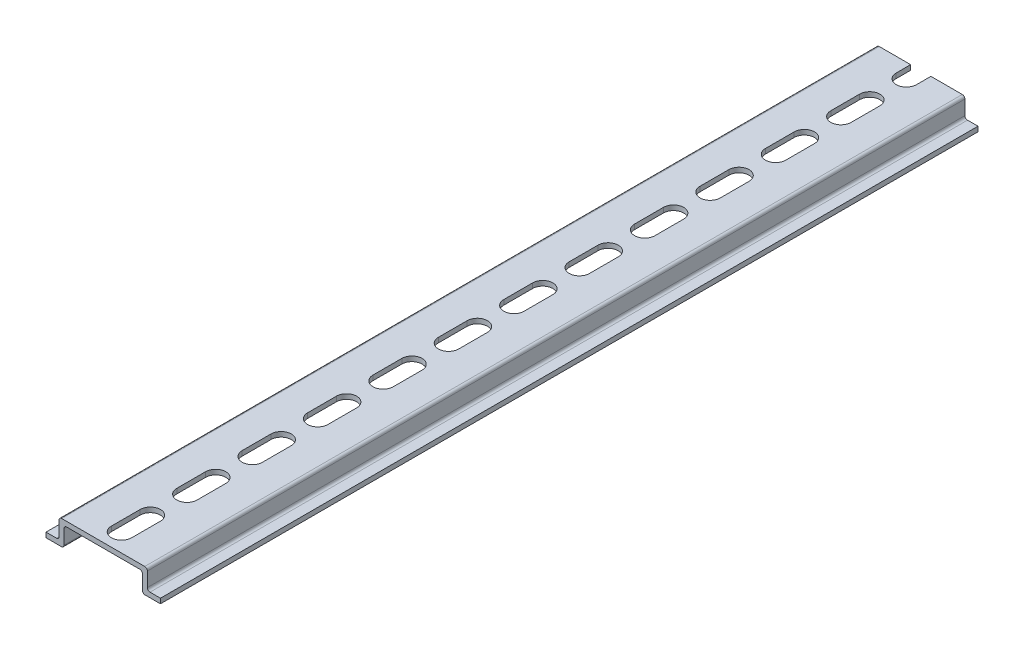
from build123d import *

# Parameters (mm, degrees)
EXTRUDE_1_DEPTH     = 250
CUT_EXTRUDE_2_DEPTH = 7.5


with BuildPart() as part:
    # 草图1 → 凸台-拉伸1 (new body)
    with BuildSketch(Plane.XY):
        with BuildLine():
            Line((-17.5, 0), (-12.8, 0))
            ThreePointArc((-12.8, 0), (-12.234314575, 0.234314575), (-12, 0.8))
            Line((-12, 0.8), (-12, 5.2))
            ThreePointArc((-12, 5.2), (-11.765685425, 5.765685425), (-11.2, 6))
            Line((-11.2, 6), (11.2, 6))
            ThreePointArc((11.2, 6), (11.765685425, 5.765685425), (12, 5.2))
            Line((12, 5.2), (12, 0.8))
            ThreePointArc((12, 0.8), (12.234314575, 0.234314575), (12.8, 0))
            Line((12.8, 0), (17.5, 0))
            Line((17.5, 0), (17.5, 1.5))
            Line((17.5, 1.5), (14.3, 1.5))
            ThreePointArc((14.3, 1.5), (13.734314575, 1.734314575), (13.5, 2.3))
            Line((13.5, 2.3), (13.5, 6.7))
            ThreePointArc((13.5, 6.7), (13.265685425, 7.265685425), (12.7, 7.5))
            Line((12.7, 7.5), (-12.7, 7.5))
            ThreePointArc((-12.7, 7.5), (-13.265685425, 7.265685425), (-13.5, 6.7))
            Line((-13.5, 6.7), (-13.5, 2.3))
            ThreePointArc((-13.5, 2.3), (-13.734314575, 1.734314575), (-14.3, 1.5))
            Line((-14.3, 1.5), (-17.5, 1.5))
            Line((-17.5, 1.5), (-17.5, 0))
        make_face()
    extrude(amount=EXTRUDE_1_DEPTH)

    # 草图2 → 切除-拉伸2 (cut)
    with BuildSketch(Plane(origin=(0, 0, 0), x_dir=(1, 0, 0), z_dir=(0, 1, 0))):
        with BuildLine():
            Line((3.1, 4.4), (3.1, -4.4))
            ThreePointArc((3.1, -4.4), (0, -7.5), (-3.1, -4.4))
            Line((-3.1, -4.4), (-3.1, 4.4))
            ThreePointArc((-3.1, 4.4), (0, 7.5), (3.1, 4.4))
        make_face()
        with BuildLine():
            Line((3.1, -15.6), (3.1, -24.4))
            ThreePointArc((3.1, -24.4), (0, -27.5), (-3.1, -24.4))
            Line((-3.1, -24.4), (-3.1, -15.6))
            ThreePointArc((-3.1, -15.6), (0, -12.5), (3.1, -15.6))
        make_face()
        with BuildLine():
            Line((3.1, -35.6), (3.1, -44.4))
            ThreePointArc((3.1, -44.4), (0, -47.5), (-3.1, -44.4))
            Line((-3.1, -44.4), (-3.1, -35.6))
            ThreePointArc((-3.1, -35.6), (0, -32.5), (3.1, -35.6))
        make_face()
        with BuildLine():
            Line((3.1, -55.6), (3.1, -64.4))
            ThreePointArc((3.1, -64.4), (0, -67.5), (-3.1, -64.4))
            Line((-3.1, -64.4), (-3.1, -55.6))
            ThreePointArc((-3.1, -55.6), (0, -52.5), (3.1, -55.6))
        make_face()
        with BuildLine():
            Line((3.1, -75.6), (3.1, -84.4))
            ThreePointArc((3.1, -84.4), (0, -87.5), (-3.1, -84.4))
            Line((-3.1, -84.4), (-3.1, -75.6))
            ThreePointArc((-3.1, -75.6), (0, -72.5), (3.1, -75.6))
        make_face()
        with BuildLine():
            Line((3.1, -95.6), (3.1, -104.4))
            ThreePointArc((3.1, -104.4), (0, -107.5), (-3.1, -104.4))
            Line((-3.1, -104.4), (-3.1, -95.6))
            ThreePointArc((-3.1, -95.6), (0, -92.5), (3.1, -95.6))
        make_face()
        with BuildLine():
            Line((3.1, -115.6), (3.1, -124.4))
            ThreePointArc((3.1, -124.4), (0, -127.5), (-3.1, -124.4))
            Line((-3.1, -124.4), (-3.1, -115.6))
            ThreePointArc((-3.1, -115.6), (0, -112.5), (3.1, -115.6))
        make_face()
        with BuildLine():
            Line((3.1, -135.6), (3.1, -144.4))
            ThreePointArc((3.1, -144.4), (0, -147.5), (-3.1, -144.4))
            Line((-3.1, -144.4), (-3.1, -135.6))
            ThreePointArc((-3.1, -135.6), (0, -132.5), (3.1, -135.6))
        make_face()
        with BuildLine():
            Line((3.1, -155.6), (3.1, -164.4))
            ThreePointArc((3.1, -164.4), (0, -167.5), (-3.1, -164.4))
            Line((-3.1, -164.4), (-3.1, -155.6))
            ThreePointArc((-3.1, -155.6), (0, -152.5), (3.1, -155.6))
        make_face()
        with BuildLine():
            Line((3.1, -175.6), (3.1, -184.4))
            ThreePointArc((3.1, -184.4), (0, -187.5), (-3.1, -184.4))
            Line((-3.1, -184.4), (-3.1, -175.6))
            ThreePointArc((-3.1, -175.6), (0, -172.5), (3.1, -175.6))
        make_face()
        with BuildLine():
            Line((3.1, -195.6), (3.1, -204.4))
            ThreePointArc((3.1, -204.4), (0, -207.5), (-3.1, -204.4))
            Line((-3.1, -204.4), (-3.1, -195.6))
            ThreePointArc((-3.1, -195.6), (0, -192.5), (3.1, -195.6))
        make_face()
        with BuildLine():
            Line((3.1, -215.6), (3.1, -224.4))
            ThreePointArc((3.1, -224.4), (0, -227.5), (-3.1, -224.4))
            Line((-3.1, -224.4), (-3.1, -215.6))
            ThreePointArc((-3.1, -215.6), (0, -212.5), (3.1, -215.6))
        make_face()
        with BuildLine():
            Line((3.1, -235.6), (3.1, -244.4))
            ThreePointArc((3.1, -244.4), (0, -247.5), (-3.1, -244.4))
            Line((-3.1, -244.4), (-3.1, -235.6))
            ThreePointArc((-3.1, -235.6), (0, -232.5), (3.1, -235.6))
        make_face()
    extrude(amount=CUT_EXTRUDE_2_DEPTH, mode=Mode.SUBTRACT)


solid = part.part
